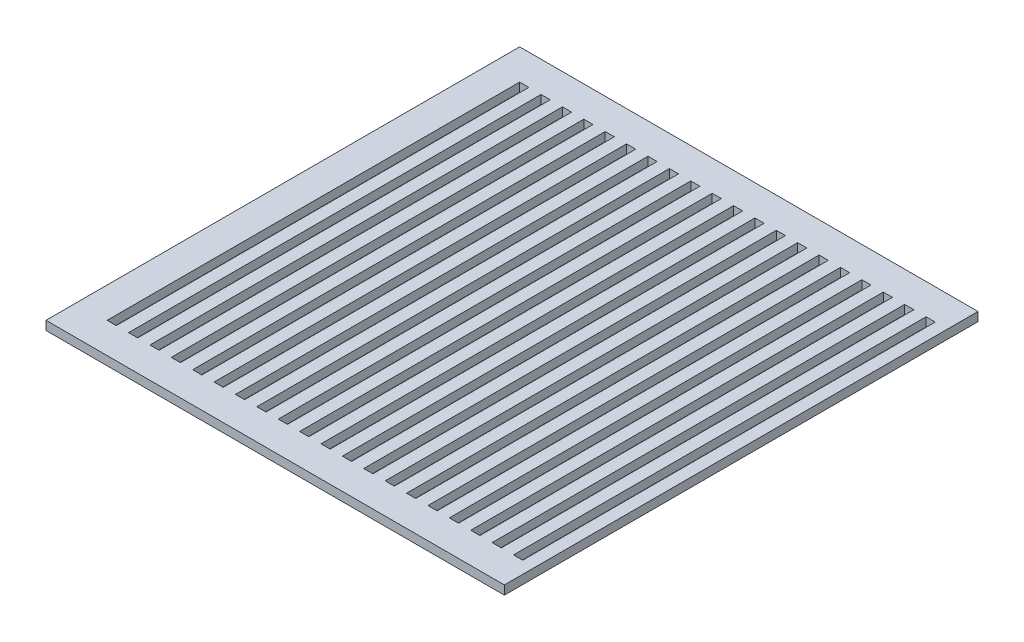
from build123d import *

# Parameters (mm, degrees)
SKETCH_1_W          = 150
SKETCH_1_H          = 155
EXTRUDE_1_DEPTH     = 2.9
SKETCH_2_W          = 3
SKETCH_2_H          = 135
CUT_EXTRUDE_4_DEPTH = 3


with BuildPart() as part:
    # 草图1 → 凸台-拉伸1 (new body)
    with BuildSketch(Plane(origin=(0, 0, 0), x_dir=(1, 0, 0), z_dir=(0, 1, 0))):
        with Locations((75, -77.5)):
            Rectangle(SKETCH_1_W, SKETCH_1_H)
    extrude(amount=EXTRUDE_1_DEPTH)

    # 草图2 → 切除-拉伸4 (cut)
    with BuildSketch(Plane(origin=(0, 2.9, 0), x_dir=(1, 0, 0), z_dir=(0, 1, 0))):
        with Locations((18.5, -77.5)):
            Rectangle(SKETCH_2_W, SKETCH_2_H)
        with Locations((11.5, -77.5)):
            Rectangle(SKETCH_2_W, SKETCH_2_H)
        with Locations((25.5, -77.5)):
            Rectangle(SKETCH_2_W, SKETCH_2_H)
        with Locations((32.5, -77.5)):
            Rectangle(SKETCH_2_W, SKETCH_2_H)
        with Locations((39.5, -77.5)):
            Rectangle(SKETCH_2_W, SKETCH_2_H)
        with Locations((46.5, -77.5)):
            Rectangle(SKETCH_2_W, SKETCH_2_H)
        with Locations((53.5, -77.5)):
            Rectangle(SKETCH_2_W, SKETCH_2_H)
        with Locations((60.5, -77.5)):
            Rectangle(SKETCH_2_W, SKETCH_2_H)
        with Locations((67.5, -77.5)):
            Rectangle(SKETCH_2_W, SKETCH_2_H)
        with Locations((74.5, -77.5)):
            Rectangle(SKETCH_2_W, SKETCH_2_H)
        with Locations((81.5, -77.5)):
            Rectangle(SKETCH_2_W, SKETCH_2_H)
        with Locations((88.5, -77.5)):
            Rectangle(SKETCH_2_W, SKETCH_2_H)
        with Locations((95.5, -77.5)):
            Rectangle(SKETCH_2_W, SKETCH_2_H)
        with Locations((102.5, -77.5)):
            Rectangle(SKETCH_2_W, SKETCH_2_H)
        with Locations((109.5, -77.5)):
            Rectangle(SKETCH_2_W, SKETCH_2_H)
        with Locations((116.5, -77.5)):
            Rectangle(SKETCH_2_W, SKETCH_2_H)
        with Locations((123.5, -77.5)):
            Rectangle(SKETCH_2_W, SKETCH_2_H)
        with Locations((130.5, -77.5)):
            Rectangle(SKETCH_2_W, SKETCH_2_H)
        with Locations((137.5, -77.5)):
            Rectangle(SKETCH_2_W, SKETCH_2_H)
        with Locations((144.5, -77.5)):
            Rectangle(SKETCH_2_W, SKETCH_2_H)
    extrude(amount=-CUT_EXTRUDE_4_DEPTH, mode=Mode.SUBTRACT)


solid = part.part
